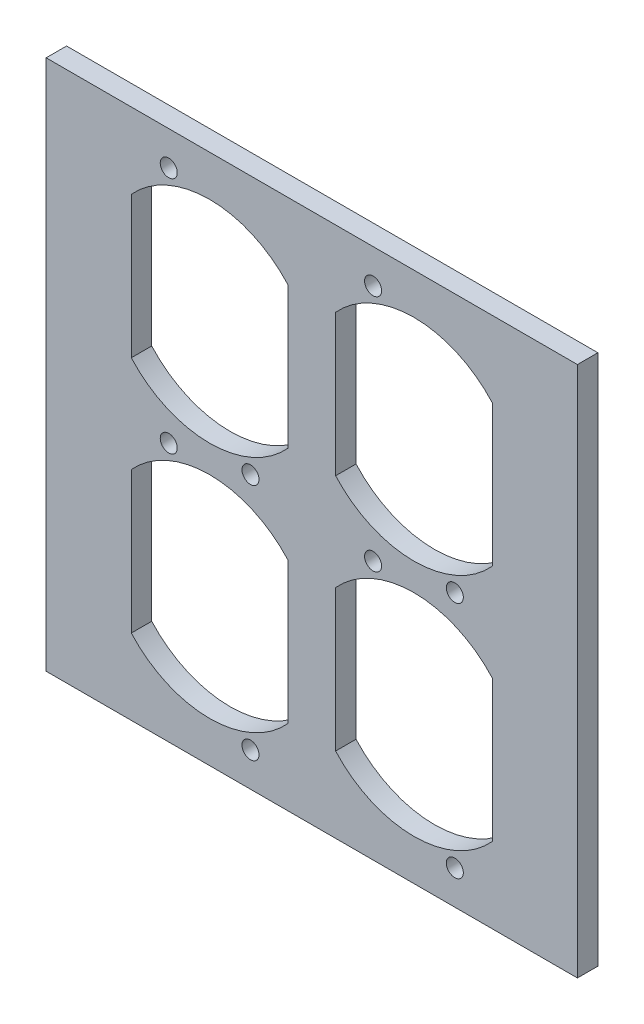
from build123d import *

# Parameters (mm, degrees)
SKETCH1_W            = 78
SKETCH1_H            = 78
BOSS_EXTRUDE1_DEPTH  = 3
CUT_EXTRUDE1_DEPTH   = 56.235857919
SKETCH3_R            = 1.25
CUT_EXTRUDE2_DEPTH   = 56.235857919
LPATTERN1_COUNT      = 2
LPATTERN1_PITCH      = 30
LPATTERN1_COUNT_DIR2 = 2
LPATTERN1_PITCH_DIR2 = 35


with BuildPart() as part:
    # Sketch1 → Boss-Extrude1 (new body)
    with BuildSketch(Plane.XY):
        Rectangle(SKETCH1_W, SKETCH1_H)
    extrude(amount=BOSS_EXTRUDE1_DEPTH)

    # Sketch2 → Cut-Extrude1 (cut, through all)
    with BuildSketch(Plane(origin=(0, 0, 0), x_dir=(-1, 0, 0), z_dir=(0, 0, -1))):
        with BuildLine():
            Line((-26.5, 27.892304845), (-26.5, 7.107695155))
            ThreePointArc((-26.5, 7.107695155), (-15, 2), (-3.5, 7.107695155))
            Line((-3.5, 7.107695155), (-3.5, 27.892304845))
            ThreePointArc((-3.5, 27.892304845), (-15, 33), (-26.5, 27.892304845))
        make_face()
    cut_extrude1 = extrude(amount=-CUT_EXTRUDE1_DEPTH, mode=Mode.SUBTRACT)

    # Sketch3 → Cut-Extrude2 (cut, through all)
    with BuildSketch(Plane(origin=(0, 0, 0), x_dir=(-1, 0, 0), z_dir=(0, 0, -1))):
        with Locations((-21, 1)):
            Circle(SKETCH3_R)
        with Locations((-9, 34)):
            Circle(SKETCH3_R)
    cut_extrude2 = extrude(amount=-CUT_EXTRUDE2_DEPTH, mode=Mode.SUBTRACT)

    # LPattern1: Cut-Extrude1, Cut-Extrude2 2 × 2
    with Locations(*[(-i * LPATTERN1_PITCH, -j * LPATTERN1_PITCH_DIR2, 0) for i in range(LPATTERN1_COUNT) for j in range(LPATTERN1_COUNT_DIR2) if (i, j) != (0, 0)]):
        add(cut_extrude1, mode=Mode.SUBTRACT)
        add(cut_extrude2, mode=Mode.SUBTRACT)


solid = part.part
